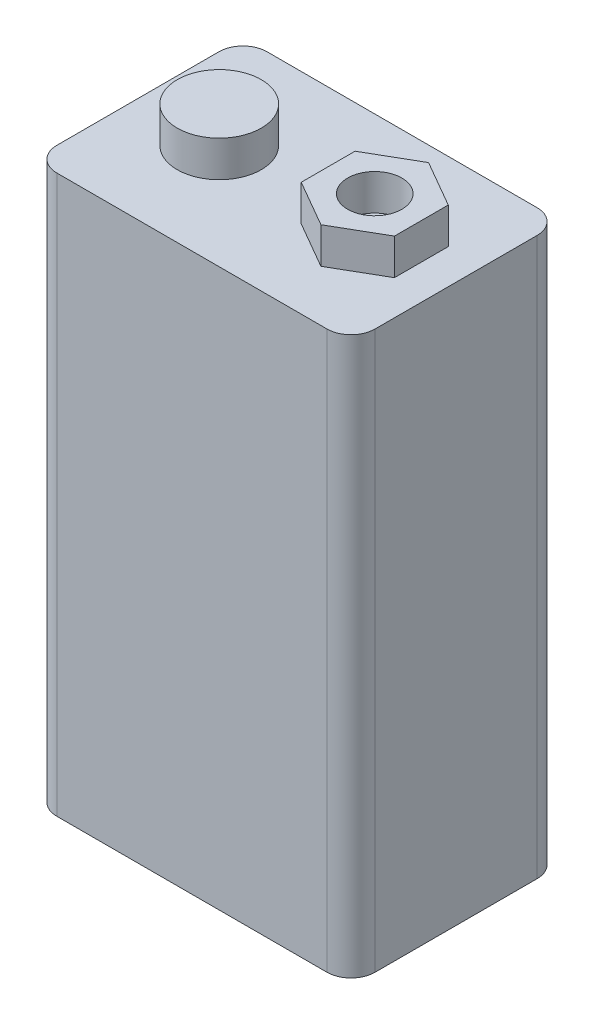
from build123d import *

# Parameters (mm, degrees)
BOSS_EXTRUDE1_DEPTH = 46.4
SKETCH2_R           = 3.5
SKETCH2_R_2         = 2.259315118
BOSS_EXTRUDE2_DEPTH = 3


with BuildPart() as part:
    # Sketch1 → Boss-Extrude1 (new body)
    with BuildSketch(Plane(origin=(0, 0, 0), x_dir=(1, 0, 0), z_dir=(0, 1, 0))):
        with BuildLine():
            Line((-11.25, -8.75), (11.25, -8.75))
            ThreePointArc((11.25, -8.75), (12.664213562, -8.164213562), (13.25, -6.75))
            Line((13.25, -6.75), (13.25, 6.75))
            ThreePointArc((13.25, 6.75), (12.664213562, 8.164213562), (11.25, 8.75))
            Line((11.25, 8.75), (-11.25, 8.75))
            ThreePointArc((-11.25, 8.75), (-12.664213562, 8.164213562), (-13.25, 6.75))
            Line((-13.25, 6.75), (-13.25, -6.75))
            ThreePointArc((-13.25, -6.75), (-12.664213562, -8.164213562), (-11.25, -8.75))
        make_face()
    extrude(amount=BOSS_EXTRUDE1_DEPTH)

    # Sketch2 → Boss-Extrude2 (add)
    # profile 1 of 2: a face of its own
    with BuildSketch(Plane(origin=(0, 46.4, 0), x_dir=(1, 0, 0), z_dir=(0, 1, 0))):
        with Locations(Location((-6.475, 0, 0), (0, 0, 270))):
            Circle(SKETCH2_R)
    # profile 2 of 2: a face of its own
    with BuildSketch(Plane(origin=(0, 46.4, 0), x_dir=(1, 0, 0), z_dir=(0, 1, 0))):
        Polygon((6.475, 4.48194599), (2.593520914, 2.240972995), (2.593520914, -2.240972995), (6.475, -4.48194599), (10.356479086, -2.240972995), (10.356479086, 2.240972995), align=None)
        with Locations(Location((6.475, 0, 0), (0, 0, 270))):
            Circle(SKETCH2_R_2, mode=Mode.SUBTRACT)
    extrude(amount=BOSS_EXTRUDE2_DEPTH)


solid = part.part
